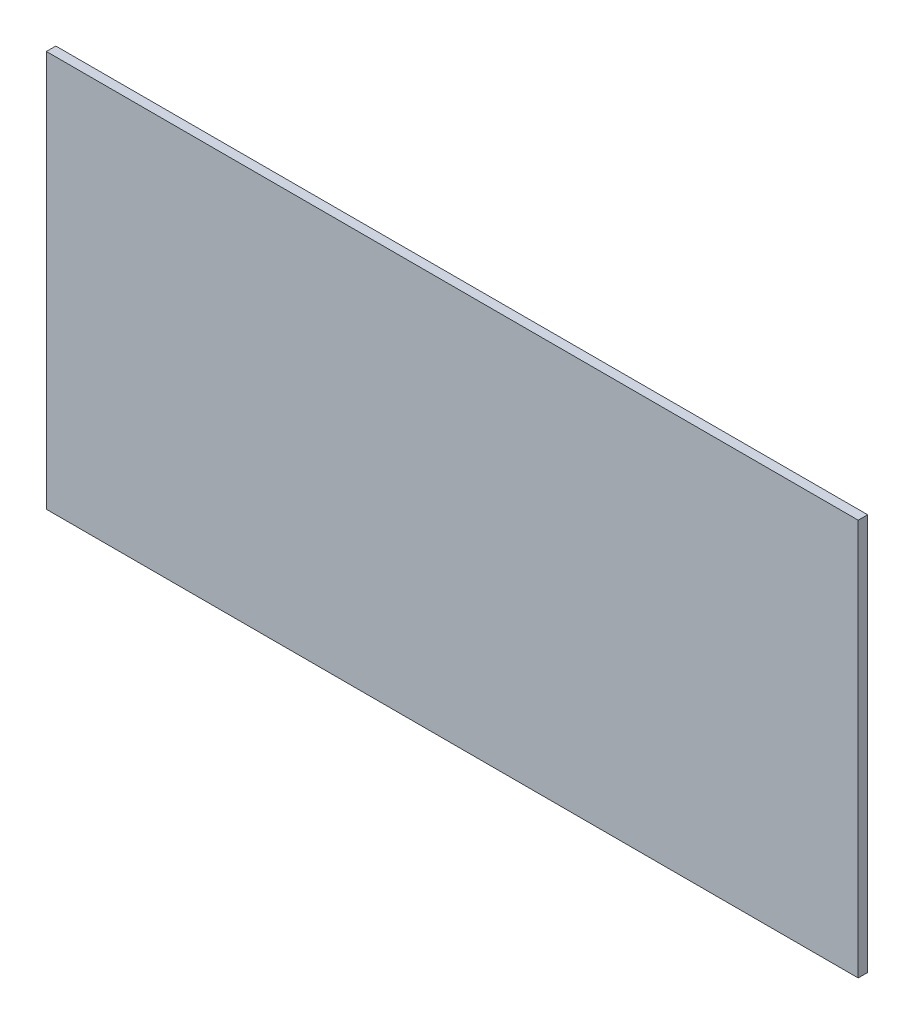
from build123d import *

# Parameters (mm, degrees)
SKETCH1_W     = 86
SKETCH1_H     = 42
PROFILE_DEPTH = 1


with BuildPart() as part:
    # Sketch1 → Profile (new body)
    with BuildSketch(Plane.XY):
        with Locations((43, 21)):
            Rectangle(SKETCH1_W, SKETCH1_H)
    extrude(amount=PROFILE_DEPTH)


solid = part.part
